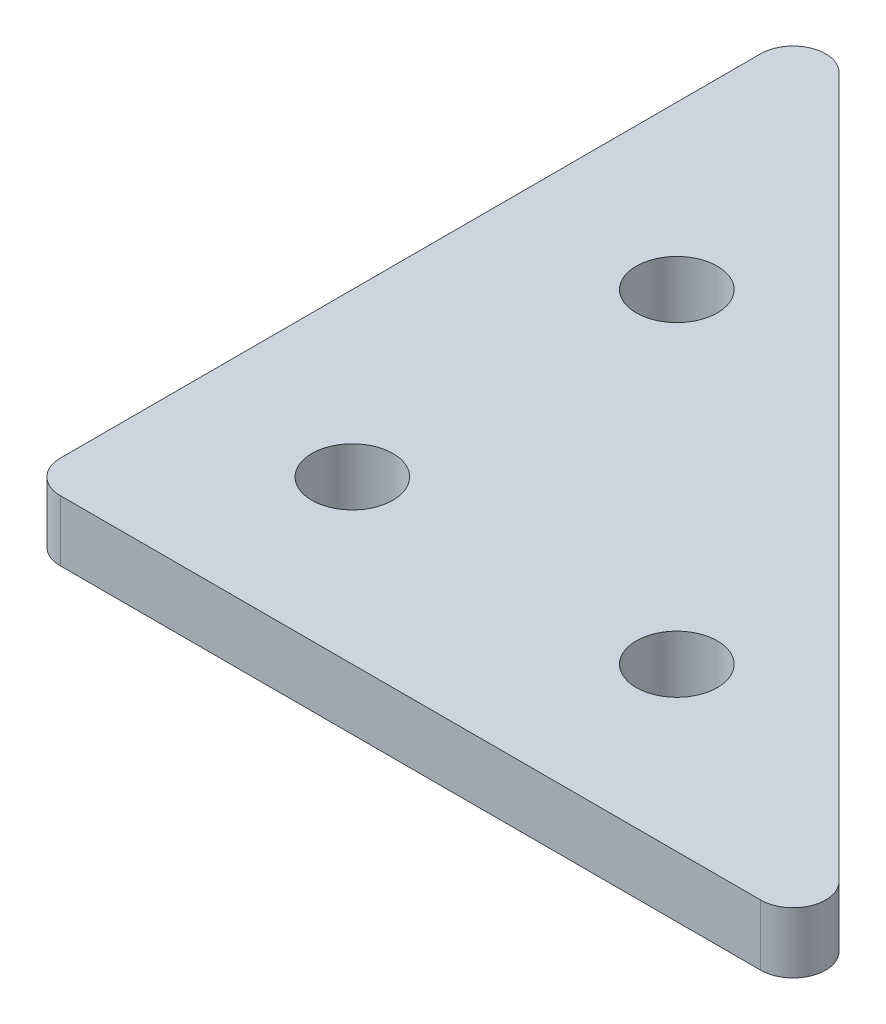
from build123d import *

# Parameters (mm, degrees)
BOSS_EXTRUDE1_DEPTH         = 4.7625
F_1_4_0_25_DIAMETER_HOLE1_D = 6.35


with BuildPart() as part:
    # Sketch1 → Boss-Extrude1 (new body)
    with BuildSketch(Plane(origin=(0, 0, 0), x_dir=(1, 0, 0), z_dir=(0, 1, 0))):
        with BuildLine():
            Line((-431.938028743, -442.700646237), (-377.110131192, -442.700646237))
            ThreePointArc((-377.110131192, -442.700646237), (-374.763477179, -441.132662155), (-375.314079967, -438.364595013))
            Line((-375.314079967, -438.364595013), (-430.141977519, -383.536697461))
            ThreePointArc((-430.141977519, -383.536697461), (-432.910044661, -382.986094673), (-434.478028743, -385.332748685))
            Line((-434.478028743, -385.332748685), (-434.478028743, -440.160646237))
            ThreePointArc((-434.478028743, -440.160646237), (-433.734079967, -441.956697461), (-431.938028743, -442.700646237))
        make_face()
    extrude(amount=BOSS_EXTRUDE1_DEPTH)

    # 1/4 (0.25) Diameter Hole1 (through all)
    with Locations(Plane(origin=(0, 4.7625, 0), x_dir=(1, 0, 0), z_dir=(0, 1, 0))):
        with Locations((-421.778028743, -404.600646237), (-421.778028743, -430.000646237), (-396.378028743, -430.000646237)):
            Hole(F_1_4_0_25_DIAMETER_HOLE1_D / 2)


solid = part.part
